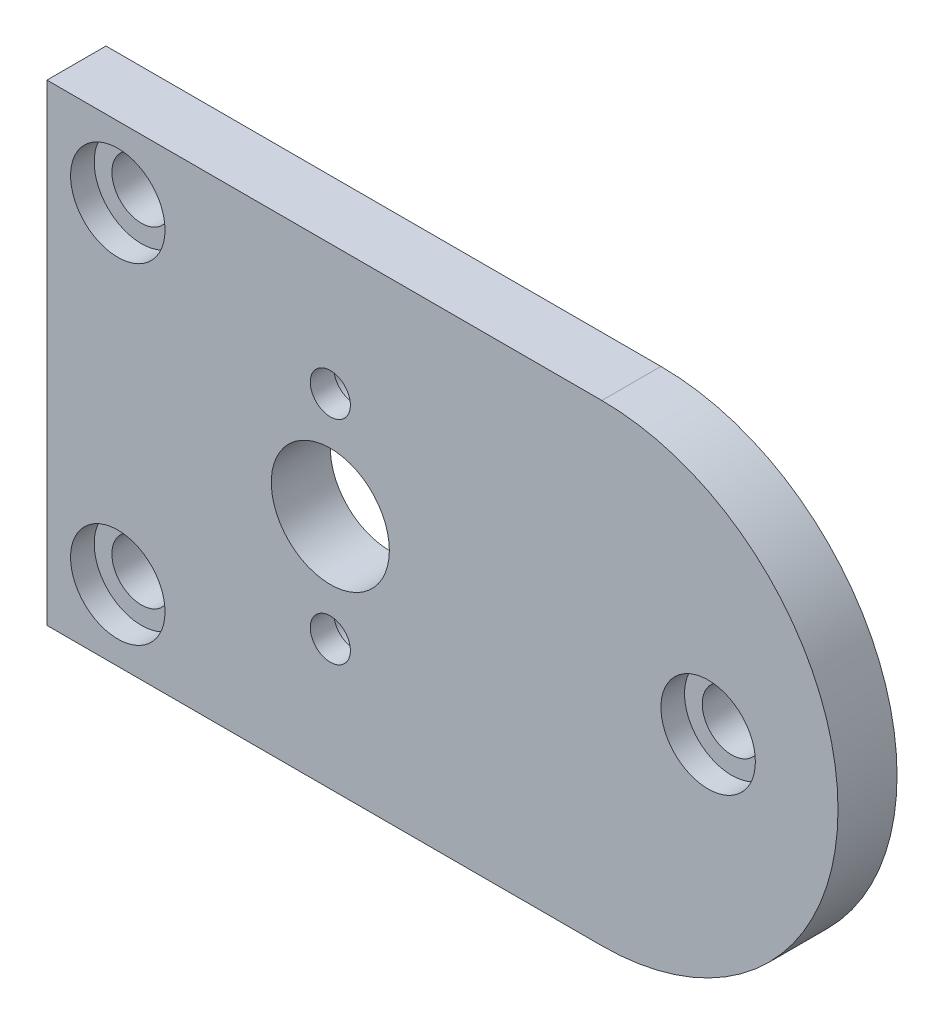
from build123d import *

# Parameters (mm, degrees)
SKETCH_1_R          = 2.5
SKETCH_1_R_2        = 0.85
SKETCH_1_R_3        = 1.25
EXTRUDE_1_DEPTH     = 1.25
CUT_EXTRUDE_START   = 1.25
SKETCH_1_4_R        = 1.1
CUT_EXTRUDE_1_DEPTH = 1.5
CUT_EXTRUDE_START_2 = -1.25
SKETCH_1_5_R        = 2
CUT_EXTRUDE_3_DEPTH = 1
SKETCH_2_W          = 43.696581843
SKETCH_2_H          = 27.281666247
CUT_EXTRUDE_4_DEPTH = 27.804850307


with BuildPart() as part:
    # 草图1 → 凸台-拉伸1 (new, symmetric)
    with BuildSketch(Plane.XY):
        with BuildLine():
            Line((11.5, 10), (-12, 10))
            Line((-12, 10), (-12, -10))
            Line((-12, -10), (11.5, -10))
            ThreePointArc((11.5, -10), (21.5, 0), (11.5, 10))
        make_face()
        Circle(SKETCH_1_R, mode=Mode.SUBTRACT)
        with Locations((0, 4.5)):
            Circle(SKETCH_1_R_2, mode=Mode.SUBTRACT)
        with Locations((0, -4.5)):
            Circle(SKETCH_1_R_2, mode=Mode.SUBTRACT)
        with Locations((-9, 7)):
            Circle(SKETCH_1_R_3, mode=Mode.SUBTRACT)
        with Locations((-9, -7)):
            Circle(SKETCH_1_R_3, mode=Mode.SUBTRACT)
        with Locations((16, 0)):
            Circle(SKETCH_1_R_3, mode=Mode.SUBTRACT)
    extrude(amount=EXTRUDE_1_DEPTH, both=True)

    # 草图1<4> → 切除-拉伸1 (cut)
    with BuildSketch(Plane.XY.offset(CUT_EXTRUDE_START)):
        with Locations((0, 4.5)):
            Circle(SKETCH_1_4_R)
        with Locations((0, -4.5)):
            Circle(SKETCH_1_4_R)
    extrude(amount=-CUT_EXTRUDE_1_DEPTH, mode=Mode.SUBTRACT)

    # 草图1<5> → 切除-拉伸3 (cut)
    with BuildSketch(Plane.XY.offset(CUT_EXTRUDE_START_2)):
        with Locations((-9, 7)):
            Circle(SKETCH_1_5_R)
        with Locations((-9, -7)):
            Circle(SKETCH_1_5_R)
        with Locations((16, 0)):
            Circle(SKETCH_1_5_R)
    extrude(amount=CUT_EXTRUDE_3_DEPTH, mode=Mode.SUBTRACT)


with BuildPart() as body_2:
    # 镜向1: mirrored copy
    add(part.part.mirror(Plane.XY.offset(11.25)))


with BuildPart() as part_1:
    add(part.part)

    # 草图2 → 切除-拉伸4 (cut, through all)
    with BuildSketch(Plane.XY.offset(11.25)):
        with Locations((2.339417989, -1.05223818)):
            Rectangle(SKETCH_2_W, SKETCH_2_H)
    extrude(amount=-CUT_EXTRUDE_4_DEPTH, mode=Mode.SUBTRACT)


solid = body_2.part
